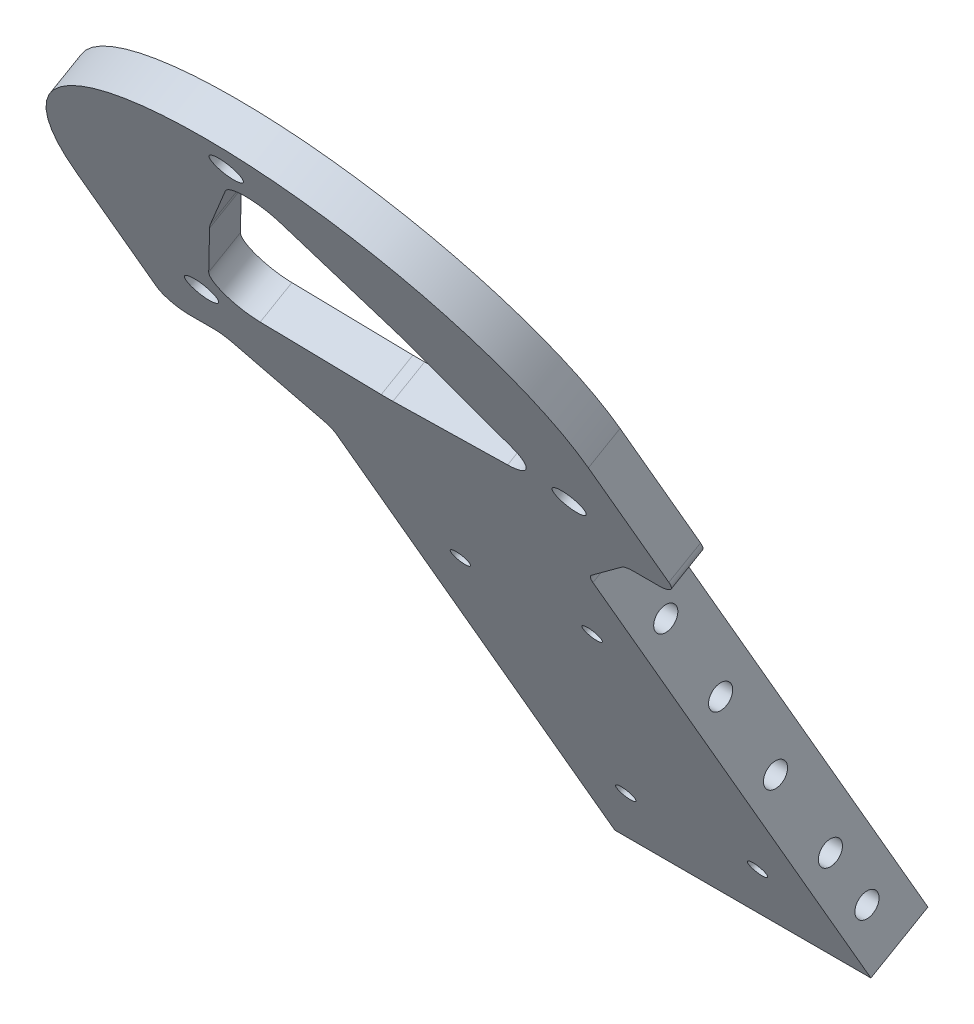
from build123d import *

# Parameters (mm, degrees)
SKETCH_1_W                = 35
SKETCH_1_H                = 10
EXTRUDE_1_DEPTH           = 30
SKETCH_2_R                = 1.65
CUT_EXTRUDE_1_DEPTH       = 47.368092477
SKETCH_3_W                = 35
SKETCH_3_H                = 10
FILLET_1_R                = 5
SKETCH_6_W                = 70
SKETCH_6_H                = 60
EXTRUDE_2_DEPTH           = 10
CHAMFER_1_SIZE            = 10
CUT_EXTRUDE_3_DEPTH       = 15
SKETCH_8_R                = 15
CUT_EXTRUDE_4_DEPTH       = 15
SKETCH_10_R               = 2.1
CUT_EXTRUDE_6_DEPTH       = 156.505811286
SKETCH_11_R               = 4.5
CUT_EXTRUDE_7_DEPTH       = 156.505811286
CUT_EXTRUDE_12_DEPTH      = 25
CUT_EXTRUDE_10_DEPTH      = 156.505811286
CUT_EXTRUDE_10_DEPTH_BACK = 156.505811286
SKETCH_14_W               = 35
SKETCH_14_H               = 27.103629711
SKETCH_15_W               = 35
SKETCH_15_H               = 10
EXTRUDE_3_DEPTH           = 23
CUT_EXTRUDE_11_DEPTH      = 164.332579917
CUT_EXTRUDE_11_DEPTH_BACK = 164.332579917
SKETCH_16_R               = 1.65
FILLET_2_R                = 3
CUT_EXTRUDE_START         = -4
CUT_EXTRUDE_13_DEPTH      = 4
SKETCH_19_W               = 35
SKETCH_19_H               = 24
EXTRUDE_4_DEPTH           = 6
CUT_EXTRUDE_14_DEPTH      = 162.92960956
CUT_EXTRUDE_14_DEPTH_BACK = 162.92960956
SKETCH_20_R               = 1.65
CUT_EXTRUDE_15_DEPTH      = 1
SKETCH_22_R               = 1.65
CUT_EXTRUDE_16_DEPTH      = 162.378361072
CUT_EXTRUDE_17_DEPTH      = 162.378361072
CUT_EXTRUDE_17_DEPTH_BACK = 162.378361072
SKETCH_25_R               = 1.25
CUT_EXTRUDE_18_DEPTH      = 10


with BuildPart() as part:
    # 草图1 → 凸台-拉伸1 (new body)
    with BuildSketch(Plane.XY):
        Rectangle(SKETCH_1_W, SKETCH_1_H)
    extrude(amount=EXTRUDE_1_DEPTH)

    # 草图2 → 切除-拉伸1 (cut, through all)
    with BuildSketch(Plane(origin=(17.5, 0, 0), x_dir=(0, 0, -1), z_dir=(1, 0, 0))):
        with Locations((-26, 0)):
            Circle(SKETCH_2_R)
        with Locations((-4, 0)):
            Circle(SKETCH_2_R)
    extrude(amount=-CUT_EXTRUDE_1_DEPTH, mode=Mode.SUBTRACT)

    # 扫描3: sweep along a path in 草图4
    with BuildLine(Plane(origin=(0, 0, 0), x_dir=(0, 0, -1), z_dir=(1, 0, 0))) as sweep_3_path:
        Line((-30, 0), (-31.113248654, 0))
        ThreePointArc((-31.113248654, 0), (-33.613248654, 0.669872981), (-35.443375673, 2.5))
        Line((-35.443375673, 2.5), (-99, 112.583302492))
    # 草图3 → 扫描3 (sweep)
    with BuildSketch(Plane.XY.offset(30)):
        Rectangle(SKETCH_3_W, SKETCH_3_H)
    sweep(path=sweep_3_path.line)

    # 圆角1
    fillet_1_edges = [part.edges().sort_by_distance(p)[0] for p in [
        (0, 5, 31.113248654),
    ]]
    fillet(fillet_1_edges, radius=FILLET_1_R)

    # 草图6 → 凸台-拉伸2 (add)
    with BuildSketch(Plane(origin=(0, -12.222431864, 21.169872981), x_dir=(-1, 0, 0), z_dir=(0, 0.4999999999999983, -0.8660254037844396))):
        with Locations((0, 117)):
            Rectangle(SKETCH_6_W, SKETCH_6_H)
    extrude(amount=-EXTRUDE_2_DEPTH)

    # 倒角1
    chamfer_1_edges = [part.edges().sort_by_distance(p)[0] for p in [
        (17.5, 60.621778265, 69),
        (-17.5, 60.621778265, 69),
    ]]
    chamfer(chamfer_1_edges, length=CHAMFER_1_SIZE)

    # 草图7 → 切除-拉伸3 (cut)
    with BuildSketch(Plane(origin=(0, -12.222431864, 21.169872981), x_dir=(-1, 0, 0), z_dir=(0, 0.4999999999999983, -0.8660254037844396))):
        with BuildLine():
            Line((-35, 147), (-35, 112))
            ThreePointArc((-35, 112), (-24.748737372, 136.748737311), (-8.6e-08, 147))
            Line((-8.6e-08, 147), (-35, 147))
        make_face()
        with BuildLine():
            ThreePointArc((-8.6e-08, 147), (24.748737311, 136.748737372), (35, 112))
            Line((35, 112), (35, 147))
            Line((35, 147), (-8.6e-08, 147))
        make_face()
    extrude(amount=-CUT_EXTRUDE_3_DEPTH, mode=Mode.SUBTRACT)

    # 草图8 → 切除-拉伸4 (cut)
    with BuildSketch(Plane(origin=(0, -12.222431864, 21.169872981), x_dir=(-1, 0, 0), z_dir=(0, 0.4999999999999983, -0.8660254037844396))):
        with Locations(Location((0, 112, 0), (0, 0, 90))):
            Circle(SKETCH_8_R)
    extrude(amount=-CUT_EXTRUDE_4_DEPTH, mode=Mode.SUBTRACT)

    # 草图10 → 切除-拉伸6 (cut, through all)
    with BuildSketch(Plane(origin=(0, -12.222431864, 21.169872981), x_dir=(-1, 0, 0), z_dir=(0, 0.4999999999999983, -0.8660254037844396))):
        with Locations(Location((0, 141, 0), (0, 0, 90))):
            Circle(SKETCH_10_R)
        with Locations(Location((-25.11473671, 97.5, 0), (0, 0, 90))):
            Circle(SKETCH_10_R)
        with Locations(Location((25.11473671, 97.5, 0), (0, 0, 90))):
            Circle(SKETCH_10_R)
    extrude(amount=-CUT_EXTRUDE_6_DEPTH, mode=Mode.SUBTRACT)

    # 草图11 → 切除-拉伸7 (cut, through all)
    with BuildSketch(Plane(origin=(0, -12.222431864, 21.169872981), x_dir=(-1, 0, 0), z_dir=(0, 0.4999999999999983, -0.8660254037844396))):
        with Locations((-16.670989023, 102.375)):
            Circle(SKETCH_11_R)
        with Locations((16.670989023, 102.375)):
            Circle(SKETCH_11_R)
    extrude(amount=-CUT_EXTRUDE_7_DEPTH, mode=Mode.SUBTRACT)

    # 草图12 → 切除-拉伸12 (cut)
    with BuildSketch(Plane(origin=(0, -12.222431864, 21.169872981), x_dir=(-1, 0, 0), z_dir=(0, 0.4999999999999983, -0.8660254037844396))):
        with BuildLine():
            Line((-20.682503653, 104.414056246), (-13.371715434, 118.796854152))
            ThreePointArc((-13.371715434, 118.796854152), (-12.990381057, 119.5), (-12.572106078, 120.181818182))
            Line((-12.572106078, 120.181818182), (-3.771631823, 133.704545455))
            ThreePointArc((-3.771631823, 133.704545455), (0, 135.75), (3.771631823, 133.704545455))
            Line((3.771631823, 133.704545455), (12.572106078, 120.181818182))
            ThreePointArc((12.572106078, 120.181818182), (12.990381057, 119.5), (13.371715434, 118.796854152))
            Line((13.371715434, 118.796854152), (20.682503653, 104.414056246))
            ThreePointArc((20.682503653, 104.414056246), (20.56810334, 100.125), (16.91087183, 97.8813983))
            Line((16.91087183, 97.8813983), (0.799609356, 97.021327666))
            ThreePointArc((0.799609356, 97.021327666), (0, 97), (-0.799609356, 97.021327666))
            Line((-0.799609356, 97.021327666), (-16.91087183, 97.8813983))
            ThreePointArc((-16.91087183, 97.8813983), (-20.56810334, 100.125), (-20.682503653, 104.414056246))
        make_face()
    extrude(amount=-CUT_EXTRUDE_12_DEPTH, mode=Mode.SUBTRACT)

    # 草图14 → 切除-拉伸10 (cut, two sides: drawn at the far end of the back side and taken through both)
    with BuildSketch(Plane(origin=(0, -12.222431864, 21.169872981), x_dir=(-1, 0, 0), z_dir=(0, 0.4999999999999983, -0.8660254037844396)).offset(-CUT_EXTRUDE_10_DEPTH_BACK)):
        with Locations((0, 9.221687837)):
            Rectangle(SKETCH_14_W, SKETCH_14_H)
    extrude(amount=CUT_EXTRUDE_10_DEPTH + CUT_EXTRUDE_10_DEPTH_BACK, mode=Mode.SUBTRACT)

    # 草图15 → 凸台-拉伸3 (add)
    with BuildSketch(Plane(origin=(0, 19.722431864, 11.386751346), x_dir=(1, 0, 0), z_dir=(0, -0.8660254037844397, -0.4999999999999984))):
        with Locations((0, 29.444863729)):
            Rectangle(SKETCH_15_W, SKETCH_15_H)
    extrude(amount=EXTRUDE_3_DEPTH)

    # 草图16 → 切除-拉伸11 (cut, two sides: drawn at the far end of the back side and taken through both)
    with BuildSketch(Plane(origin=(17.5, 0, 0), x_dir=(0, 0, -1), z_dir=(1, 0, 0)).offset(-CUT_EXTRUDE_11_DEPTH_BACK)):
        with Locations((-29.386751346, -7.990381057)):
            Circle(SKETCH_16_R)
        with Locations((-34.386751346, 0.669872981)):
            Circle(SKETCH_16_R)
    extrude(amount=CUT_EXTRUDE_11_DEPTH + CUT_EXTRUDE_11_DEPTH_BACK, mode=Mode.SUBTRACT)

    # 圆角2
    fillet_2_edges = [part.edges().sort_by_distance(p)[0] for p in [
        (-35, 60.621778265, 69),
        (35, 60.621778265, 69),
        (-17.5, 51.961524227, 64),
        (-27.5, 60.621778265, 69),
        (27.5, 60.621778265, 69),
        (17.5, 51.961524227, 64),
    ]]
    fillet(fillet_2_edges, radius=FILLET_2_R)

    # 草图18 → 切除-拉伸13 (cut)
    with BuildSketch(Plane(origin=(0, -12.222431864, 21.169872981), x_dir=(-1, 0, 0), z_dir=(0, 0.4999999999999983, -0.8660254037844396)).offset(CUT_EXTRUDE_START)):
        with BuildLine():
            Line((-17.5, 75.757359313), (17.5, 75.757359313))
            ThreePointArc((17.5, 75.757359313), (17.728361402, 76.90540961), (18.378679656, 77.878679656))
            Line((18.378679656, 77.878679656), (26.621320344, 86.121320344))
            ThreePointArc((26.621320344, 86.121320344), (27.59459039, 86.771638598), (28.742640687, 87))
            Line((28.742640687, 87), (32, 87))
            ThreePointArc((32, 87), (34.121320344, 87.878679656), (35, 90))
            Line((35, 90), (35, 112))
            ThreePointArc((35, 112), (0, 147), (-35, 112))
            Line((-35, 112), (-35, 90))
            ThreePointArc((-35, 90), (-34.121320344, 87.878679656), (-32, 87))
            Line((-32, 87), (-28.742640687, 87))
            ThreePointArc((-28.742640687, 87), (-27.59459039, 86.771638598), (-26.621320344, 86.121320344))
            Line((-26.621320344, 86.121320344), (-18.378679656, 77.878679656))
            ThreePointArc((-18.378679656, 77.878679656), (-17.728361402, 76.90540961), (-17.5, 75.757359313))
        make_face()
    extrude(amount=CUT_EXTRUDE_13_DEPTH, mode=Mode.SUBTRACT)

    # 草图19 → 凸台-拉伸4 (add)
    with BuildSketch(Plane(origin=(0, -12.222431864, 21.169872981), x_dir=(-1, 0, 0), z_dir=(0, 0.4999999999999983, -0.8660254037844396))):
        with Locations((0, 11.773502692)):
            Rectangle(SKETCH_19_W, SKETCH_19_H)
    extrude(amount=EXTRUDE_4_DEPTH)

    # 草图20 → 切除-拉伸14 (cut, two sides: drawn at the far end of the back side and taken through both)
    with BuildSketch(Plane.ZY.offset(17.5).offset(-CUT_EXTRUDE_14_DEPTH_BACK)):
        with Locations(Location((29.386751346, -7.990381057, 0), (0, 0, 180))):
            Circle(SKETCH_20_R)
        with Locations(Location((34.386751346, 0.669872981, 0), (0, 0, 180))):
            Circle(SKETCH_20_R)
        with Locations((22.458548116, -3.990381057)):
            Circle(SKETCH_20_R)
        with Locations((27.458548116, 4.669872981)):
            Circle(SKETCH_20_R)
    extrude(amount=CUT_EXTRUDE_14_DEPTH + CUT_EXTRUDE_14_DEPTH_BACK, mode=Mode.SUBTRACT)

    # 草图21 → 切除-拉伸15 (cut)
    with BuildSketch(Plane(origin=(0, -17.222431864, 29.830127019), x_dir=(1, 0, 0), z_dir=(0, -0.4999999999999983, 0.8660254037844396))):
        with BuildLine():
            Line((-35, 112), (-35, 90))
            ThreePointArc((-35, 90), (-34.121320344, 87.878679656), (-32, 87))
            Line((-32, 87), (-28.742640687, 87))
            ThreePointArc((-28.742640687, 87), (-27.59459039, 86.771638598), (-26.621320344, 86.121320344))
            Line((-26.621320344, 86.121320344), (-18.378679656, 77.878679656))
            ThreePointArc((-18.378679656, 77.878679656), (-17.728361402, 76.90540961), (-17.5, 75.757359313))
            Line((-17.5, 75.757359313), (-17.5, -0.226497308))
            Line((-17.5, -0.226497308), (17.5, -0.226497308))
            Line((17.5, -0.226497308), (17.5, 75.757359313))
            ThreePointArc((17.5, 75.757359313), (17.728361402, 76.90540961), (18.378679656, 77.878679656))
            Line((18.378679656, 77.878679656), (26.621320344, 86.121320344))
            ThreePointArc((26.621320344, 86.121320344), (27.59459039, 86.771638598), (28.742640687, 87))
            Line((28.742640687, 87), (32, 87))
            ThreePointArc((32, 87), (34.121320344, 87.878679656), (35, 90))
            Line((35, 90), (35, 112))
            ThreePointArc((35, 112), (0, 147), (-35, 112))
        make_face()
    extrude(amount=-CUT_EXTRUDE_15_DEPTH, mode=Mode.SUBTRACT)

    # 草图22 → 切除-拉伸16 (cut, through all)
    with BuildSketch(Plane.ZY.offset(17.5)):
        with Locations((49.386751346, 26.650635095)):
            Circle(SKETCH_22_R)
        with Locations((56.886751346, 39.641016151)):
            Circle(SKETCH_22_R)
        with Locations((41.886751346, 13.660254038)):
            Circle(SKETCH_22_R)
    extrude(amount=-CUT_EXTRUDE_16_DEPTH, mode=Mode.SUBTRACT)

    # 草图23 → 切除-拉伸17 (cut, two sides: drawn at the far end of the back side and taken through both)
    with BuildSketch(Plane(origin=(17.5, 0, 0), x_dir=(0, 0, -1), z_dir=(1, 0, 0)).offset(-CUT_EXTRUDE_17_DEPTH_BACK)):
        Polygon((-59.048552638, 53.385365824), (-21.056624327, -12.418584287), (-8.944037263, -5.425378885), align=None)
    extrude(amount=CUT_EXTRUDE_17_DEPTH + CUT_EXTRUDE_17_DEPTH_BACK, mode=Mode.SUBTRACT)

    # 草图25 → 切除-拉伸18 (cut)
    with BuildSketch(Plane(origin=(0, -12.222431864, 21.169872981), x_dir=(-1, 0, 0), z_dir=(0, 0.4999999999999981, -0.8660254037844397))):
        with Locations(Location((-9, 58.973502692, 0), (0, 0, 90))):
            Circle(SKETCH_25_R)
        with Locations(Location((9, 58.973502692, 0), (0, 0, 90))):
            Circle(SKETCH_25_R)
        with Locations(Location((-9, 13.773502692, 0), (0, 0, 90))):
            Circle(SKETCH_25_R)
        with Locations(Location((9, 13.773502692, 0), (0, 0, 90))):
            Circle(SKETCH_25_R)
    extrude(amount=-CUT_EXTRUDE_18_DEPTH, mode=Mode.SUBTRACT)


solid = part.part
